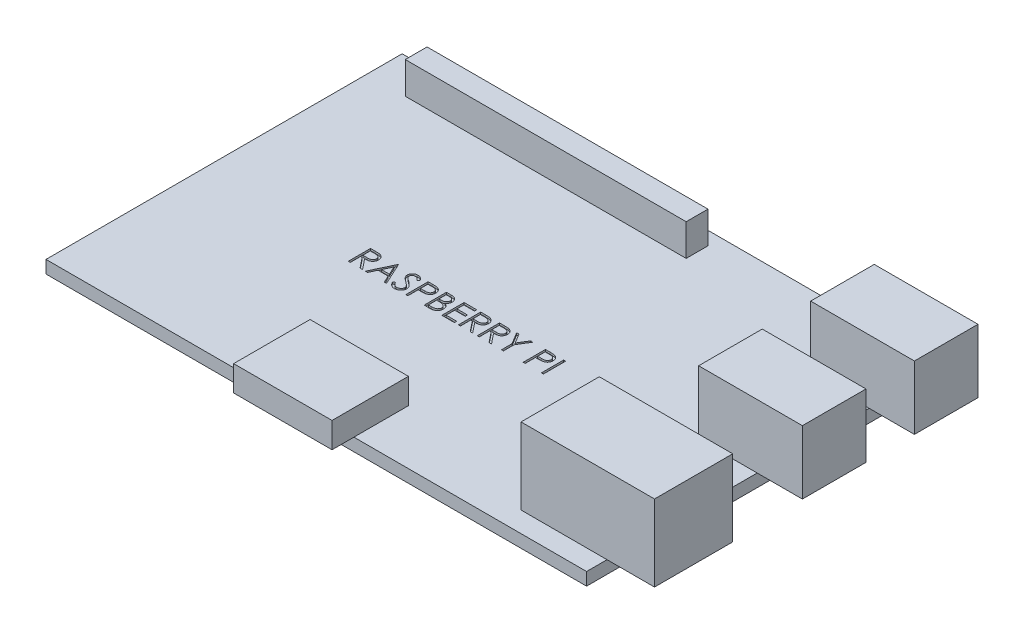
from build123d import *

# Parameters (mm, degrees)
SKETCH1_W           = 85
SKETCH1_H           = 56
BOSS_EXTRUDE1_DEPTH = 2
SKETCH2_W           = 44.16989505
SKETCH2_H           = 3.429859275
BOSS_EXTRUDE2_DEPTH = 5
SKETCH3_W           = 16.312745331
SKETCH3_H           = 10
BOSS_EXTRUDE3_DEPTH = 10
SKETCH4_W           = 20.982820563
SKETCH4_H           = 12.302427533
BOSS_EXTRUDE4_DEPTH = 12
SKETCH5_W           = 15.469882956
SKETCH5_H           = 12.011909119
BOSS_EXTRUDE5_DEPTH = 4
SKETCH6_W           = 0.314102564
SKETCH6_H           = 3.5
CUT_EXTRUDE1_DEPTH  = 0.3


with BuildPart() as part:
    # Sketch1 → Boss-Extrude1 (new body)
    with BuildSketch(Plane(origin=(0, 0, 0), x_dir=(1, 0, 0), z_dir=(0, 1, 0))):
        with Locations((42.5, 28)):
            Rectangle(SKETCH1_W, SKETCH1_H)
    extrude(amount=BOSS_EXTRUDE1_DEPTH)

    # Sketch2 → Boss-Extrude2 (add)
    with BuildSketch(Plane(origin=(0, 2, 0), x_dir=(1, 0, 0), z_dir=(0, 1, 0))):
        with Locations((28.111322067, 52.176325132)):
            Rectangle(SKETCH2_W, SKETCH2_H)
    extrude(amount=BOSS_EXTRUDE2_DEPTH)

    # Sketch3 → Boss-Extrude3 (add)
    with BuildSketch(Plane(origin=(0, 2, 0), x_dir=(1, 0, 0), z_dir=(0, 1, 0))):
        with Locations((83.951104162, 49.438227987)):
            Rectangle(SKETCH3_W, SKETCH3_H)
        with Locations((83.951104162, 31.8256135)):
            Rectangle(SKETCH3_W, SKETCH3_H)
    extrude(amount=BOSS_EXTRUDE3_DEPTH)

    # Sketch4 → Boss-Extrude4 (add)
    with BuildSketch(Plane(origin=(0, 2, 0), x_dir=(1, 0, 0), z_dir=(0, 1, 0))):
        with Locations((81.970867379, 9.368512449)):
            Rectangle(SKETCH4_W, SKETCH4_H)
    extrude(amount=BOSS_EXTRUDE4_DEPTH)

    # Sketch5 → Boss-Extrude5 (add)
    with BuildSketch(Plane(origin=(0, 2, 0), x_dir=(1, 0, 0), z_dir=(0, 1, 0))):
        with Locations((40.680180829, 2.565692434)):
            Rectangle(SKETCH5_W, SKETCH5_H)
    extrude(amount=BOSS_EXTRUDE5_DEPTH)

    # Sketch6 → Cut-Extrude1 (cut)
    # profile 1 of 11: a face of its own
    with BuildSketch(Plane(origin=(0, 2, 0), x_dir=(1, 0, 0), z_dir=(0, 1, 0))):
        with BuildLine():
            Line((24.021028214, 27.004389936), (24.721448888, 27.004389936))
            add(Edge.make_bspline(
                [(24.721448888, 27.004389936), (24.768190016, 27.00423435), (24.85793816, 27.003935608), (24.986511431, 27.002269845), (25.103338528, 26.99749549), (25.208358367, 26.993386906), (25.301569022, 26.985894965), (25.383256313, 26.978734318), (25.45304401, 26.969360657), (25.495289862, 26.960655234), (25.514417638, 26.956713654)],
                knots=[0, 0, 0, 0, 1.410062039, 2.707475311, 3.878576406, 4.937260626, 5.877586885, 6.699081471, 7.410979367, 8, 8, 8, 8], degree=3))
            add(Edge.make_bspline(
                [(25.514417638, 26.956713654), (25.540024262, 26.950386889), (25.590691251, 26.937868325), (25.663641317, 26.911408725), (25.733155641, 26.8807891), (25.798945465, 26.84482538), (25.860681257, 26.8032506), (25.918999567, 26.756782478), (25.974165031, 26.705675272), (26.023946661, 26.64864043), (26.070885713, 26.588803921), (26.110474339, 26.524100164), (26.144600819, 26.456438636), (26.171771336, 26.385131218), (26.193649309, 26.310869447), (26.209075549, 26.23298065), (26.218326736, 26.151819675), (26.219268592, 26.096461766), (26.219746163, 26.06839234)],
                knots=[0, 0, 0, 0, 1.027469482, 2.033020251, 3.019912614, 3.986113645, 4.951240523, 5.91722682, 6.890402269, 7.87763091, 8.8651537, 9.85103654, 10.82876324, 11.815024772, 12.821070561, 13.842952187, 14.906261191, 16, 16, 16, 16], degree=3))
            add(Edge.make_bspline(
                [(26.219746163, 26.06839234), (26.218277165, 26.021757236), (26.215410769, 25.930760068), (26.188685666, 25.798699186), (26.144909146, 25.675509872), (26.084585857, 25.561347234), (26.007766381, 25.458436588), (25.91544159, 25.368046133), (25.807559979, 25.292406221), (25.707130663, 25.239953416), (25.618416463, 25.206360507), (25.54538315, 25.182724148), (25.465716173, 25.164462183), (25.380178838, 25.148102051), (25.288415183, 25.135750357), (25.190645143, 25.126703762), (25.086798992, 25.121049714), (25.015459922, 25.120207709), (24.978760586, 25.119774552)],
                knots=[0, 0, 0, 0, 1.260483769, 2.459530307, 3.627416485, 4.787058657, 5.939039949, 7.08810263, 8.267026773, 9.491475466, 10.141966685, 10.831826277, 11.566392101, 12.351337768, 13.187381173, 14.07005841, 15.007169909, 16, 16, 16, 16], degree=3))
            Line((24.978760586, 25.119774552), (26.264617958, 23.504389936))
            Line((26.264617958, 23.504389936), (25.876196484, 23.504389936))
            Line((25.876196484, 23.504389936), (24.590339112, 25.119774552))
            Line((24.590339112, 25.119774552), (24.335130779, 25.119774552))
            Line((24.335130779, 25.119774552), (24.335130779, 23.504389936))
            Line((24.335130779, 23.504389936), (24.021028214, 23.504389936))
            Line((24.021028214, 23.504389936), (24.021028214, 27.004389936))
        make_face()
        with BuildLine():
            Line((24.335130779, 26.645415577), (24.335130779, 25.478748911))
            Line((24.335130779, 25.478748911), (24.975956099, 25.473841058))
            add(Edge.make_bspline(
                [(24.975956099, 25.473841058), (25.005876138, 25.473827822), (25.063869695, 25.473802165), (25.14777036, 25.477795941), (25.225890472, 25.48233926), (25.297931224, 25.489288605), (25.363924799, 25.498244677), (25.423838212, 25.509447661), (25.477769264, 25.522499724), (25.540667803, 25.54270135), (25.610904334, 25.574707368), (25.687235794, 25.621272867), (25.752238132, 25.679841986), (25.807155994, 25.746815442), (25.851285425, 25.820451691), (25.88239748, 25.89986806), (25.902139922, 25.983059658), (25.904468467, 26.040237766), (25.905643599, 26.069093462)],
                knots=[0, 0, 0, 0, 1.146690395, 2.22261258, 3.21895312, 4.145990853, 4.996080663, 5.770904154, 6.481378293, 7.121626537, 8.300444488, 9.431385265, 10.535395872, 11.636531494, 12.74115979, 13.810798291, 14.895190096, 16, 16, 16, 16], degree=3))
            add(Edge.make_bspline(
                [(25.905643599, 26.069093462), (25.904441478, 26.097240036), (25.902059313, 26.153016275), (25.882610544, 26.234672185), (25.849721163, 26.311739135), (25.805398925, 26.38390362), (25.75139977, 26.449409356), (25.688081957, 26.505456509), (25.617176762, 26.551705974), (25.550905564, 26.581260354), (25.491671351, 26.599380207), (25.440241691, 26.612131371), (25.382130213, 26.62237584), (25.317054755, 26.630583901), (25.245293124, 26.637638845), (25.166482473, 26.642390624), (25.081145693, 26.645204488), (25.021998761, 26.645343577), (24.991380779, 26.645415577)],
                knots=[0, 0, 0, 0, 1.101028733, 2.181837193, 3.264309656, 4.369019818, 5.486613113, 6.575447106, 7.666700264, 8.788928104, 9.402425223, 10.0903467, 10.862060571, 11.710948788, 12.657782767, 13.684531032, 14.801375019, 16, 16, 16, 16], degree=3))
            Line((24.991380779, 26.645415577), (24.335130779, 26.645415577))
        make_face(mode=Mode.SUBTRACT)
    # profile 2 of 11: a face of its own
    with BuildSketch(Plane(origin=(0, 2, 0), x_dir=(1, 0, 0), z_dir=(0, 1, 0))):
        Polygon((28.418464112, 27.004389936), (30.033848727, 23.504389936), (29.692402413, 23.504389936), (29.174974529, 24.626184808), (27.588335907, 24.626184808), (27.056184464, 23.504389936), (26.713335907, 23.504389936), (28.373592317, 27.004389936), align=None)
        Polygon((28.392522605, 26.32219843), (27.758708503, 24.985159167), (29.009509785, 24.985159167), align=None, mode=Mode.SUBTRACT)
    # profile 3 of 11: a face of its own
    with BuildSketch(Plane(origin=(0, 2, 0), x_dir=(1, 0, 0), z_dir=(0, 1, 0))):
        with BuildLine():
            Line((30.303079496, 24.179570225), (30.598952894, 24.356954039))
            add(Edge.make_bspline(
                [(30.598952894, 24.356954039), (30.626471131, 24.310889654), (30.679195012, 24.22263207), (30.767146371, 24.10337403), (30.858279282, 24.002011873), (30.953268616, 23.919135265), (31.051534564, 23.853886379), (31.153718618, 23.807684147), (31.259476428, 23.778868172), (31.33145025, 23.775368085), (31.367382381, 23.773620706)],
                knots=[0, 0, 0, 0, 1.272034388, 2.437168799, 3.508375237, 4.49857839, 5.41946034, 6.295179144, 7.148887113, 8, 8, 8, 8], degree=3))
            add(Edge.make_bspline(
                [(31.367382381, 23.773620706), (31.398069242, 23.774475378), (31.458906015, 23.776169768), (31.548468258, 23.792450571), (31.63545006, 23.817462699), (31.718058698, 23.853283631), (31.795154312, 23.896622117), (31.862761007, 23.948968294), (31.921207121, 24.0075745), (31.969016235, 24.072957155), (32.005696271, 24.143274303), (32.033888339, 24.215450254), (32.049533413, 24.290618823), (32.051890166, 24.341229286), (32.053079496, 24.366769744)],
                knots=[0, 0, 0, 0, 1.095163259, 2.171163733, 3.241058638, 4.321873601, 5.38011039, 6.391990106, 7.366004449, 8.327778327, 9.272591725, 10.192022065, 11.087607919, 12, 12, 12, 12], degree=3))
            add(Edge.make_bspline(
                [(32.053079496, 24.366769744), (32.051605186, 24.395910594), (32.048608128, 24.455149683), (32.023276648, 24.542549336), (31.983427401, 24.629041906), (31.946664757, 24.682543172), (31.927578695, 24.710319424)],
                knots=[0, 0, 0, 0, 0.938893495, 1.908633276, 2.914225137, 4, 4, 4, 4], degree=3))
            add(Edge.make_bspline(
                [(31.927578695, 24.710319424), (31.911908081, 24.730366247), (31.879009587, 24.772452046), (31.822452074, 24.835097281), (31.75608596, 24.8997157), (31.682182405, 24.968774757), (31.598049316, 25.039062554), (31.506321802, 25.113930832), (31.404657943, 25.190532409), (31.333358446, 25.241904974), (31.29656908, 25.268412372)],
                knots=[0, 0, 0, 0, 0.722233717, 1.516239348, 2.393582979, 3.351407094, 4.387010283, 5.505090956, 6.712668013, 8, 8, 8, 8], degree=3))
            add(Edge.make_bspline(
                [(31.29656908, 25.268412372), (31.259745084, 25.29464096), (31.189340407, 25.344788022), (31.090881825, 25.419212306), (31.002837362, 25.487256176), (30.925598345, 25.549560188), (30.859198748, 25.606132793), (30.803115337, 25.656430732), (30.75877678, 25.701814293), (30.7341212, 25.731255634), (30.723051452, 25.744474071)],
                knots=[0, 0, 0, 0, 1.452282411, 2.77665338, 3.964542531, 5.026858415, 5.96415736, 6.766646006, 7.446254459, 8, 8, 8, 8], degree=3))
            add(Edge.make_bspline(
                [(30.723051452, 25.744474071), (30.707578906, 25.765075108), (30.67715007, 25.805589812), (30.636984064, 25.868914669), (30.602844901, 25.933737935), (30.576082569, 26.000233799), (30.55354635, 26.067468728), (30.53838842, 26.136319974), (30.528897023, 26.206478592), (30.527925036, 26.253692093), (30.527438471, 26.277326635)],
                knots=[0, 0, 0, 0, 1.068054152, 2.10047183, 3.106115577, 4.101338837, 5.06977816, 6.043150881, 7.020423561, 8, 8, 8, 8], degree=3))
            add(Edge.make_bspline(
                [(30.527438471, 26.277326635), (30.52874368, 26.31435641), (30.5313262, 26.387624473), (30.553166717, 26.494655304), (30.587639611, 26.596841721), (30.635934499, 26.693172055), (30.698191852, 26.781138036), (30.770237826, 26.861751523), (30.856049312, 26.929520105), (30.950201935, 26.988732163), (31.053258308, 27.035078089), (31.161249211, 27.070039069), (31.274346283, 27.089848326), (31.350949418, 27.092691091), (31.389818279, 27.094133526)],
                knots=[0, 0, 0, 0, 1.005424448, 1.989358655, 2.955360095, 3.929531133, 4.905563448, 5.876582895, 6.856512386, 7.866279853, 8.892233794, 9.918561126, 10.94386622, 12, 12, 12, 12], degree=3))
            add(Edge.make_bspline(
                [(31.389818279, 27.094133526), (31.431062379, 27.092710975), (31.513083731, 27.089881974), (31.633732946, 27.065284442), (31.749893663, 27.02458377), (31.843336927, 26.978395112), (31.916469689, 26.932263697), (31.972242422, 26.890243872), (32.028759872, 26.841868764), (32.086477927, 26.787009518), (32.144418587, 26.725162767), (32.203442039, 26.656752078), (32.263686308, 26.582195522), (32.302442168, 26.528971021), (32.322310266, 26.50168561)],
                knots=[0, 0, 0, 0, 1.286793592, 2.559021753, 3.825965368, 5.121522368, 5.803751409, 6.523245864, 7.299691795, 8.125521123, 9.008227632, 9.944561021, 10.946284179, 12, 12, 12, 12], degree=3))
            Line((32.322310266, 26.50168561), (32.038355939, 26.286441219))
            add(Edge.make_bspline(
                [(32.038355939, 26.286441219), (32.021210006, 26.308529909), (31.988190949, 26.351067562), (31.938061462, 26.410638878), (31.890812814, 26.465055357), (31.844262415, 26.512320485), (31.800868783, 26.555022619), (31.758751741, 26.591582375), (31.71851739, 26.622357971), (31.667800479, 26.655201531), (31.604082761, 26.687758034), (31.524098225, 26.715307113), (31.440511949, 26.731862174), (31.383582318, 26.734051062), (31.354762189, 26.735159167)],
                knots=[0, 0, 0, 0, 1.181633172, 2.275549214, 3.290209073, 4.226197932, 5.078386478, 5.862611352, 6.581680152, 7.217281963, 8.414376989, 9.595101626, 10.782541182, 12, 12, 12, 12], degree=3))
            add(Edge.make_bspline(
                [(31.354762189, 26.735159167), (31.318605666, 26.733947467), (31.248881219, 26.731610818), (31.149890983, 26.706090833), (31.060797058, 26.665908972), (30.984244493, 26.609593994), (30.920507516, 26.542873002), (30.874402057, 26.466094147), (30.846651892, 26.381311744), (30.843265613, 26.322170088), (30.841541035, 26.292050193)],
                knots=[0, 0, 0, 0, 1.14458467, 2.207223713, 3.21896685, 4.227309161, 5.202851033, 6.127160689, 7.046193047, 8, 8, 8, 8], degree=3))
            add(Edge.make_bspline(
                [(30.841541035, 26.292050193), (30.841934162, 26.273298714), (30.842721058, 26.235765095), (30.853695855, 26.180313673), (30.867795184, 26.125002334), (30.890137816, 26.070079751), (30.92098312, 26.014585392), (30.961488296, 25.957563654), (31.012501608, 25.898511945), (31.05157862, 25.860104572), (31.072210105, 25.839826635)],
                knots=[0, 0, 0, 0, 0.858281714, 1.717966888, 2.583508476, 3.4729293, 4.427298488, 5.488583878, 6.674047936, 8, 8, 8, 8], degree=3))
            add(Edge.make_bspline(
                [(31.072210105, 25.839826635), (31.079871478, 25.832989609), (31.098073145, 25.816746401), (31.131349071, 25.79015412), (31.175291869, 25.757351348), (31.22875407, 25.716764032), (31.292721432, 25.669682569), (31.367200988, 25.616708957), (31.451362521, 25.556123498), (31.511084437, 25.513765958), (31.54266283, 25.491369103)],
                knots=[0, 0, 0, 0, 0.420754252, 0.999615792, 1.744751191, 2.668019286, 3.750313428, 4.999500688, 6.413464383, 8, 8, 8, 8], degree=3))
            add(Edge.make_bspline(
                [(31.54266283, 25.491369103), (31.580648743, 25.463727744), (31.6542032, 25.410204082), (31.758860779, 25.329788402), (31.853754588, 25.251140633), (31.939217791, 25.174763026), (32.0160947, 25.101234933), (32.08353242, 25.029671753), (32.142218101, 24.96058618), (32.205397319, 24.872013604), (32.269955139, 24.76323252), (32.325396646, 24.629954282), (32.360354993, 24.496157961), (32.364926509, 24.406231125), (32.367182061, 24.361861892)],
                knots=[0, 0, 0, 0, 1.163667725, 2.253281268, 3.268753668, 4.215851969, 5.092017293, 5.902905408, 6.650798638, 7.335211899, 8.59617414, 9.77448103, 10.901945474, 12, 12, 12, 12], degree=3))
            add(Edge.make_bspline(
                [(32.367182061, 24.361861892), (32.366524922, 24.330483526), (32.365223407, 24.268336143), (32.350262494, 24.177081066), (32.328342828, 24.088450196), (32.295305595, 24.003539084), (32.254982436, 23.920794321), (32.203816188, 23.842386421), (32.144508504, 23.766580022), (32.076474739, 23.695396531), (32.002028836, 23.630050335), (31.923345142, 23.571921273), (31.840294869, 23.52345295), (31.753328552, 23.483902108), (31.662426215, 23.45296859), (31.567618432, 23.430555721), (31.46874892, 23.41680001), (31.401548439, 23.415372249), (31.367382381, 23.414646347)],
                knots=[0, 0, 0, 0, 0.983748083, 1.948392443, 2.894712957, 3.844097841, 4.80183111, 5.778335162, 6.776009319, 7.81870978, 8.863265674, 9.881300176, 10.883814829, 11.87499822, 12.874611388, 13.892143829, 14.928324115, 16, 16, 16, 16], degree=3))
            add(Edge.make_bspline(
                [(31.367382381, 23.414646347), (31.340947038, 23.415157528), (31.288409278, 23.416173454), (31.210699796, 23.425154734), (31.134560207, 23.437861838), (31.060945925, 23.458035908), (30.988908513, 23.482512885), (30.918761279, 23.512651217), (30.850470225, 23.548768419), (30.783652642, 23.590063443), (30.718478467, 23.638121188), (30.655559, 23.694094684), (30.592829814, 23.756440189), (30.532142418, 23.826850753), (30.472269273, 23.904188836), (30.414390864, 23.989178019), (30.357309146, 24.081355373), (30.321493678, 24.146220458), (30.303079496, 24.179570225)],
                knots=[0, 0, 0, 0, 0.915332311, 1.819136955, 2.706846663, 3.586547465, 4.459518054, 5.340707479, 6.227863349, 7.133153174, 8.059268498, 9.028702269, 10.047606654, 11.120612155, 12.245963614, 13.433783089, 14.680604001, 16, 16, 16, 16], degree=3))
        make_face()
    # profile 4 of 11: a face of its own
    with BuildSketch(Plane(origin=(0, 2, 0), x_dir=(1, 0, 0), z_dir=(0, 1, 0))):
        with BuildLine():
            Line((33.085130779, 27.004389936), (33.771529016, 27.004389936))
            add(Edge.make_bspline(
                [(33.771529016, 27.004389936), (33.818739922, 27.00433804), (33.909198115, 27.004238605), (34.03891317, 27.001223859), (34.156722902, 26.997197167), (34.262373283, 26.991615274), (34.356189381, 26.985018683), (34.437746681, 26.975766644), (34.507686237, 26.966106348), (34.549592686, 26.956284942), (34.568704496, 26.951805802)],
                knots=[0, 0, 0, 0, 1.415646017, 2.712440637, 3.8905458, 4.950247383, 5.884950622, 6.709939814, 7.411656543, 8, 8, 8, 8], degree=3))
            add(Edge.make_bspline(
                [(34.568704496, 26.951805802), (34.59289803, 26.945183852), (34.640715007, 26.93209599), (34.709616051, 26.905882267), (34.775169896, 26.874800102), (34.837601455, 26.839376162), (34.896143538, 26.798090598), (34.951669579, 26.75261698), (35.003689559, 26.701905411), (35.051910951, 26.646524671), (35.096195748, 26.587404462), (35.134325431, 26.523662232), (35.166252658, 26.456370928), (35.19363593, 26.385577357), (35.213344384, 26.310687034), (35.228191284, 26.232220321), (35.237614911, 26.150185631), (35.238517473, 26.094125764), (35.238976932, 26.065587853)],
                knots=[0, 0, 0, 0, 0.999701418, 1.975846123, 2.934577507, 3.890451536, 4.834027766, 5.787354733, 6.749476667, 7.726910423, 8.712836071, 9.690891519, 10.682875813, 11.679750201, 12.712814741, 13.765529915, 14.8625177, 16, 16, 16, 16], degree=3))
            add(Edge.make_bspline(
                [(35.238976932, 26.065587853), (35.238555508, 26.036810076), (35.237730962, 25.980504412), (35.227834676, 25.898131624), (35.214504485, 25.819413234), (35.194007432, 25.744523784), (35.167161759, 25.673908013), (35.135669706, 25.606486781), (35.097686176, 25.543407109), (35.054041346, 25.484439992), (35.005489752, 25.429530079), (34.952236814, 25.379075285), (34.894497521, 25.333370946), (34.832455373, 25.292314603), (34.765505524, 25.256858323), (34.694663371, 25.225101018), (34.619313154, 25.198429958), (34.56717064, 25.184399896), (34.540659625, 25.177266539)],
                knots=[0, 0, 0, 0, 1.121902311, 2.195077645, 3.232258892, 4.234102512, 5.217864754, 6.176164875, 7.132989551, 8.084763148, 9.034132444, 9.988522005, 10.94243251, 11.903244335, 12.886203696, 13.894208494, 14.929344452, 16, 16, 16, 16], degree=3))
            add(Edge.make_bspline(
                [(34.540659625, 25.177266539), (34.518732291, 25.172603558), (34.470677263, 25.162384364), (34.391534541, 25.150975907), (34.299389155, 25.141238306), (34.194366875, 25.133937169), (34.07656197, 25.1276868), (33.945910713, 25.122718706), (33.802156636, 25.119988852), (33.701885392, 25.11984806), (33.649533823, 25.119774552)],
                knots=[0, 0, 0, 0, 0.601384939, 1.31797006, 2.144135048, 3.087295005, 4.142315834, 5.309527816, 6.595305764, 8, 8, 8, 8], degree=3))
            Line((33.649533823, 25.119774552), (33.399233343, 25.119774552))
            Line((33.399233343, 25.119774552), (33.399233343, 23.504389936))
            Line((33.399233343, 23.504389936), (33.085130779, 23.504389936))
            Line((33.085130779, 23.504389936), (33.085130779, 27.004389936))
        make_face()
        with BuildLine():
            Line((33.399233343, 26.645415577), (33.399233343, 25.478748911))
            Line((33.399233343, 25.478748911), (34.012013791, 25.471036571))
            add(Edge.make_bspline(
                [(34.012013791, 25.471036571), (34.041933717, 25.471021107), (34.099693517, 25.470991255), (34.18312974, 25.474976479), (34.260539028, 25.479577011), (34.331683603, 25.486312935), (34.396595538, 25.495834192), (34.455383066, 25.50544593), (34.507590349, 25.519351293), (34.568689551, 25.538074362), (34.636772899, 25.570006978), (34.710840447, 25.616356868), (34.773611033, 25.675437576), (34.82792933, 25.741865407), (34.871035208, 25.815764537), (34.9025912, 25.894833473), (34.921132358, 25.978261323), (34.923618551, 26.035349462), (34.924874368, 26.06418561)],
                knots=[0, 0, 0, 0, 1.160613943, 2.240541288, 3.23993089, 4.169200891, 5.011653406, 5.7853311, 6.478053781, 7.106038997, 8.262395093, 9.384106736, 10.481365981, 11.59014053, 12.70357646, 13.786202915, 14.881775077, 16, 16, 16, 16], degree=3))
            add(Edge.make_bspline(
                [(34.924874368, 26.06418561), (34.923611722, 26.092324123), (34.921101737, 26.148260005), (34.902445874, 26.230238766), (34.87109656, 26.30847447), (34.827639965, 26.381447555), (34.774898835, 26.447636359), (34.713599492, 26.505133487), (34.643886231, 26.551355189), (34.579038, 26.581188471), (34.521436814, 26.599403746), (34.471404854, 26.612148587), (34.414914179, 26.622324193), (34.3519464, 26.630563696), (34.282989566, 26.637617157), (34.207451251, 26.642403134), (34.125617608, 26.645204591), (34.068807037, 26.645343546), (34.039357541, 26.645415577)],
                knots=[0, 0, 0, 0, 1.120700087, 2.227813068, 3.331159281, 4.466773991, 5.599788987, 6.693661531, 7.80175334, 8.91857717, 9.525282508, 10.207424825, 10.974604443, 11.810962634, 12.737642355, 13.736264703, 14.826523623, 16, 16, 16, 16], degree=3))
            Line((34.039357541, 26.645415577), (33.399233343, 26.645415577))
        make_face(mode=Mode.SUBTRACT)
    # profile 5 of 11: a face of its own
    with BuildSketch(Plane(origin=(0, 2, 0), x_dir=(1, 0, 0), z_dir=(0, 1, 0))):
        with BuildLine():
            Line((35.95692565, 27.004389936), (36.639818279, 27.004389936))
            add(Edge.make_bspline(
                [(36.639818279, 27.004389936), (36.673246757, 27.004214186), (36.738039467, 27.003873538), (36.832258909, 26.998590407), (36.92050772, 26.991386737), (37.002811492, 26.979956644), (37.079132194, 26.966164867), (37.149699832, 26.949463051), (37.214290004, 26.929436437), (37.29140274, 26.897590156), (37.379323401, 26.850266988), (37.474521794, 26.780338423), (37.555926033, 26.69480596), (37.62611235, 26.598323304), (37.68191347, 26.492187532), (37.722282767, 26.378928344), (37.747840643, 26.260006602), (37.750469077, 26.178363424), (37.751797445, 26.137102276)],
                knots=[0, 0, 0, 0, 1.001505555, 1.941167018, 2.826882275, 3.653841531, 4.429895133, 5.150066043, 5.825578002, 6.45369114, 7.647487171, 8.808567382, 9.977351308, 11.170798116, 12.373658725, 13.556498008, 14.765093433, 16, 16, 16, 16], degree=3))
            add(Edge.make_bspline(
                [(37.751797445, 26.137102276), (37.750704227, 26.098449721), (37.748555949, 26.022493804), (37.72801319, 25.911399694), (37.695852522, 25.805648475), (37.651147272, 25.70562609), (37.593045276, 25.613592477), (37.524186958, 25.528805211), (37.441110155, 25.454854154), (37.378866915, 25.413511251), (37.34725017, 25.39251093)],
                knots=[0, 0, 0, 0, 1.044552857, 2.05264487, 3.044412934, 4.028983338, 5.005914585, 5.980388656, 6.974128949, 8, 8, 8, 8], degree=3))
            add(Edge.make_bspline(
                [(37.34725017, 25.39251093), (37.387010597, 25.377245931), (37.463082145, 25.348040207), (37.567768157, 25.296404743), (37.657963002, 25.240242632), (37.734360148, 25.178910782), (37.799697803, 25.112801971), (37.856750744, 25.040946857), (37.905432119, 24.962408099), (37.947145042, 24.878004564), (37.979693798, 24.788598096), (38.004069703, 24.695027319), (38.018037152, 24.597627764), (38.020024793, 24.531342385), (38.021028214, 24.49787952)],
                knots=[0, 0, 0, 0, 1.27268992, 2.434971085, 3.483601985, 4.442670788, 5.356604649, 6.2567628, 7.179492994, 8.113709626, 9.066344395, 10.018646069, 10.999752585, 12, 12, 12, 12], degree=3))
            add(Edge.make_bspline(
                [(38.021028214, 24.49787952), (38.020051368, 24.463712648), (38.018129397, 24.39648837), (38.003949425, 24.297733235), (37.979940318, 24.203358288), (37.946869171, 24.112753106), (37.903706857, 24.026092971), (37.851178892, 23.943279707), (37.788547329, 23.865145377), (37.71848446, 23.790821754), (37.639222314, 23.723993966), (37.553706559, 23.66447826), (37.46086024, 23.615532197), (37.362208246, 23.574416176), (37.256643929, 23.543008977), (37.144641322, 23.521036404), (37.02629702, 23.506231367), (36.945087269, 23.505014162), (36.903440073, 23.504389936)],
                knots=[0, 0, 0, 0, 0.978564426, 1.925352924, 2.850884081, 3.763762016, 4.682927383, 5.618979971, 6.567305752, 7.547517671, 8.540179244, 9.531824382, 10.526200242, 11.540722885, 12.589160233, 13.674978461, 14.80764778, 16, 16, 16, 16], degree=3))
            Line((36.903440073, 23.504389936), (35.95692565, 23.504389936))
            Line((35.95692565, 23.504389936), (35.95692565, 27.004389936))
        make_face()
        with BuildLine():
            Line((36.271028214, 26.645415577), (36.271028214, 25.523620706))
            Line((36.271028214, 25.523620706), (36.482065875, 25.523620706))
            add(Edge.make_bspline(
                [(36.482065875, 25.523620706), (36.51291467, 25.524020629), (36.572520829, 25.524793361), (36.658840726, 25.527006879), (36.738965744, 25.533204922), (36.812757577, 25.539401184), (36.880100021, 25.549475772), (36.940843883, 25.561467895), (36.99594248, 25.5741508), (37.059482025, 25.595720287), (37.131554974, 25.627597962), (37.208388078, 25.677069798), (37.276122547, 25.735994151), (37.333319735, 25.803985113), (37.380131206, 25.878851299), (37.412644921, 25.959398179), (37.434692205, 26.043618311), (37.436683736, 26.101436564), (37.437694881, 26.13079218)],
                knots=[0, 0, 0, 0, 1.156816544, 2.235205308, 3.236616184, 4.169592532, 5.011045266, 5.787822928, 6.49130361, 7.128639758, 8.301311294, 9.436451833, 10.541879658, 11.654887649, 12.756523258, 13.837046038, 14.901820046, 16, 16, 16, 16], degree=3))
            add(Edge.make_bspline(
                [(37.437694881, 26.13079218), (37.437168701, 26.150217952), (37.436136541, 26.188323724), (37.427683238, 26.243873078), (37.413315664, 26.29611683), (37.394861371, 26.345770941), (37.369072682, 26.391282791), (37.338709219, 26.434225987), (37.302023528, 26.473138105), (37.260266216, 26.509507603), (37.212257593, 26.541752131), (37.158026301, 26.569992894), (37.096838624, 26.592733671), (37.029725769, 26.612649824), (36.955654682, 26.626638117), (36.875480128, 26.638291505), (36.788545409, 26.644224247), (36.728400307, 26.64500961), (36.697310266, 26.645415577)],
                knots=[0, 0, 0, 0, 0.91205012, 1.789085906, 2.630437955, 3.453916878, 4.269457761, 5.079663411, 5.91843418, 6.774407191, 7.675494373, 8.627863946, 9.638891023, 10.736472738, 11.911756761, 13.175263542, 14.539845004, 16, 16, 16, 16], degree=3))
            Line((36.697310266, 26.645415577), (36.271028214, 26.645415577))
        make_face(mode=Mode.SUBTRACT)
        with BuildLine():
            Line((36.271028214, 25.164646347), (36.271028214, 23.863364295))
            Line((36.271028214, 23.863364295), (36.71834392, 23.863364295))
            add(Edge.make_bspline(
                [(36.71834392, 23.863364295), (36.750362845, 23.863748043), (36.812075104, 23.864487665), (36.901176334, 23.86690222), (36.983759438, 23.872394496), (37.059447574, 23.881040345), (37.129058026, 23.890418794), (37.191755729, 23.903030075), (37.248048923, 23.917479036), (37.313323231, 23.939813208), (37.386826739, 23.974509679), (37.466037595, 24.026823905), (37.536463813, 24.089147213), (37.596269073, 24.161278127), (37.645282061, 24.239709454), (37.680937516, 24.322854804), (37.702928373, 24.409340332), (37.705590542, 24.468307044), (37.70692565, 24.49787952)],
                knots=[0, 0, 0, 0, 1.160039823, 2.235823828, 3.228722157, 4.157150951, 4.99529583, 5.772374946, 6.472645482, 7.099169577, 8.269452708, 9.405989375, 10.527446681, 11.663510218, 12.788923519, 13.866172445, 14.929861265, 16, 16, 16, 16], degree=3))
            add(Edge.make_bspline(
                [(37.70692565, 24.49787952), (37.706649546, 24.51637286), (37.706101791, 24.553061242), (37.697841176, 24.606977061), (37.685827306, 24.659202935), (37.670295872, 24.709880675), (37.647676405, 24.758094051), (37.62126986, 24.804796611), (37.590308459, 24.85005009), (37.542064293, 24.907262344), (37.471892308, 24.973179357), (37.372185533, 25.037716859), (37.258813235, 25.089764666), (37.176585742, 25.111864142), (37.134109144, 25.123280161)],
                knots=[0, 0, 0, 0, 0.723448775, 1.435228256, 2.130040452, 2.821711965, 3.505591119, 4.210454504, 4.921174351, 5.648778258, 7.137944449, 8.670945889, 10.280296675, 12, 12, 12, 12], degree=3))
            add(Edge.make_bspline(
                [(37.134109144, 25.123280161), (37.117080048, 25.126735245), (37.080157456, 25.134226579), (37.019949875, 25.142134283), (36.951214006, 25.149179343), (36.873791129, 25.1543905), (36.787583288, 25.159777044), (36.692406369, 25.161871865), (36.588649055, 25.164371125), (36.516656682, 25.164552259), (36.479261388, 25.164646347)],
                knots=[0, 0, 0, 0, 0.634451884, 1.375622551, 2.216452059, 3.157844607, 4.20941857, 5.370758133, 6.634282058, 8, 8, 8, 8], degree=3))
            Line((36.479261388, 25.164646347), (36.271028214, 25.164646347))
        make_face(mode=Mode.SUBTRACT)
    # profile 6 of 11: a face of its own
    with BuildSketch(Plane(origin=(0, 2, 0), x_dir=(1, 0, 0), z_dir=(0, 1, 0))):
        Polygon((38.738976932, 27.004389936), (40.713335907, 27.004389936), (40.713335907, 26.645415577), (39.053079496, 26.645415577), (39.053079496, 25.568492501), (40.713335907, 25.568492501), (40.713335907, 25.209518142), (39.053079496, 25.209518142), (39.053079496, 23.863364295), (40.713335907, 23.863364295), (40.713335907, 23.504389936), (38.738976932, 23.504389936), align=None)
    # profile 7 of 11: a face of its own
    with BuildSketch(Plane(origin=(0, 2, 0), x_dir=(1, 0, 0), z_dir=(0, 1, 0))):
        with BuildLine():
            Line((41.341541035, 27.004389936), (42.041961708, 27.004389936))
            add(Edge.make_bspline(
                [(42.041961708, 27.004389936), (42.088702837, 27.00423435), (42.178450981, 27.003935608), (42.307024251, 27.002269845), (42.423851348, 26.99749549), (42.528871188, 26.993386906), (42.622081843, 26.985894965), (42.703769133, 26.978734318), (42.773556831, 26.969360657), (42.815802682, 26.960655234), (42.834930458, 26.956713654)],
                knots=[0, 0, 0, 0, 1.410062039, 2.707475311, 3.878576406, 4.937260626, 5.877586885, 6.699081471, 7.410979367, 8, 8, 8, 8], degree=3))
            add(Edge.make_bspline(
                [(42.834930458, 26.956713654), (42.860537082, 26.950386889), (42.911204072, 26.937868325), (42.984154138, 26.911408725), (43.053668462, 26.8807891), (43.119458286, 26.84482538), (43.181194077, 26.8032506), (43.239512388, 26.756782478), (43.294677851, 26.705675272), (43.344459482, 26.64864043), (43.391398533, 26.588803921), (43.43098716, 26.524100164), (43.465113639, 26.456438636), (43.492284156, 26.385131218), (43.51416213, 26.310869447), (43.529588369, 26.23298065), (43.538839557, 26.151819675), (43.539781412, 26.096461766), (43.540258984, 26.06839234)],
                knots=[0, 0, 0, 0, 1.027469482, 2.033020251, 3.019912614, 3.986113645, 4.951240523, 5.91722682, 6.890402269, 7.87763091, 8.8651537, 9.85103654, 10.82876324, 11.815024772, 12.821070561, 13.842952187, 14.906261191, 16, 16, 16, 16], degree=3))
            add(Edge.make_bspline(
                [(43.540258984, 26.06839234), (43.538789986, 26.021757236), (43.53592359, 25.930760068), (43.509198486, 25.798699186), (43.465421966, 25.675509872), (43.405098677, 25.561347234), (43.328279202, 25.458436588), (43.235954411, 25.368046133), (43.128072799, 25.292406221), (43.027643483, 25.239953416), (42.938929283, 25.206360507), (42.865895971, 25.182724148), (42.786228993, 25.164462183), (42.700691659, 25.148102051), (42.608928003, 25.135750357), (42.511157964, 25.126703762), (42.407311812, 25.121049714), (42.335972743, 25.120207709), (42.299273407, 25.119774552)],
                knots=[0, 0, 0, 0, 1.260483769, 2.459530307, 3.627416485, 4.787058657, 5.939039949, 7.08810263, 8.267026773, 9.491475466, 10.141966685, 10.831826277, 11.566392101, 12.351337768, 13.187381173, 14.07005841, 15.007169909, 16, 16, 16, 16], degree=3))
            Line((42.299273407, 25.119774552), (43.585130779, 23.504389936))
            Line((43.585130779, 23.504389936), (43.196709304, 23.504389936))
            Line((43.196709304, 23.504389936), (41.910851932, 25.119774552))
            Line((41.910851932, 25.119774552), (41.655643599, 25.119774552))
            Line((41.655643599, 25.119774552), (41.655643599, 23.504389936))
            Line((41.655643599, 23.504389936), (41.341541035, 23.504389936))
            Line((41.341541035, 23.504389936), (41.341541035, 27.004389936))
        make_face()
        with BuildLine():
            Line((41.655643599, 26.645415577), (41.655643599, 25.478748911))
            Line((41.655643599, 25.478748911), (42.29646892, 25.473841058))
            add(Edge.make_bspline(
                [(42.29646892, 25.473841058), (42.326388958, 25.473827822), (42.384382516, 25.473802165), (42.46828318, 25.477795941), (42.546403292, 25.48233926), (42.618444044, 25.489288605), (42.68443762, 25.498244677), (42.744351033, 25.509447661), (42.798282085, 25.522499724), (42.861180623, 25.54270135), (42.931417155, 25.574707368), (43.007748614, 25.621272867), (43.072750952, 25.679841986), (43.127668814, 25.746815442), (43.171798246, 25.820451691), (43.2029103, 25.89986806), (43.222652743, 25.983059658), (43.224981288, 26.040237766), (43.22615642, 26.069093462)],
                knots=[0, 0, 0, 0, 1.146690395, 2.22261258, 3.21895312, 4.145990853, 4.996080663, 5.770904154, 6.481378293, 7.121626537, 8.300444488, 9.431385265, 10.535395872, 11.636531494, 12.74115979, 13.810798291, 14.895190096, 16, 16, 16, 16], degree=3))
            add(Edge.make_bspline(
                [(43.22615642, 26.069093462), (43.224954298, 26.097240036), (43.222572133, 26.153016275), (43.203123365, 26.234672185), (43.170233983, 26.311739135), (43.125911745, 26.38390362), (43.07191259, 26.449409356), (43.008594778, 26.505456509), (42.937689583, 26.551705974), (42.871418384, 26.581260354), (42.812184172, 26.599380207), (42.760754512, 26.612131371), (42.702643034, 26.62237584), (42.637567575, 26.630583901), (42.565805945, 26.637638845), (42.486995293, 26.642390624), (42.401658513, 26.645204488), (42.342511582, 26.645343577), (42.311893599, 26.645415577)],
                knots=[0, 0, 0, 0, 1.101028733, 2.181837193, 3.264309656, 4.369019818, 5.486613113, 6.575447106, 7.666700264, 8.788928104, 9.402425223, 10.0903467, 10.862060571, 11.710948788, 12.657782767, 13.684531032, 14.801375019, 16, 16, 16, 16], degree=3))
            Line((42.311893599, 26.645415577), (41.655643599, 26.645415577))
        make_face(mode=Mode.SUBTRACT)
    # profile 8 of 11: a face of its own
    with BuildSketch(Plane(origin=(0, 2, 0), x_dir=(1, 0, 0), z_dir=(0, 1, 0))):
        with BuildLine():
            Line((44.303079496, 27.004389936), (45.00350017, 27.004389936))
            add(Edge.make_bspline(
                [(45.00350017, 27.004389936), (45.050241298, 27.00423435), (45.139989442, 27.003935608), (45.268562713, 27.002269845), (45.38538981, 26.99749549), (45.490409649, 26.993386906), (45.583620304, 26.985894965), (45.665307595, 26.978734318), (45.735095292, 26.969360657), (45.777341144, 26.960655234), (45.79646892, 26.956713654)],
                knots=[0, 0, 0, 0, 1.410062039, 2.707475311, 3.878576406, 4.937260626, 5.877586885, 6.699081471, 7.410979367, 8, 8, 8, 8], degree=3))
            add(Edge.make_bspline(
                [(45.79646892, 26.956713654), (45.822075544, 26.950386889), (45.872742533, 26.937868325), (45.945692599, 26.911408725), (46.015206923, 26.8807891), (46.080996747, 26.84482538), (46.142732539, 26.8032506), (46.201050849, 26.756782478), (46.256216313, 26.705675272), (46.305997943, 26.64864043), (46.352936995, 26.588803921), (46.392525621, 26.524100164), (46.426652101, 26.456438636), (46.453822618, 26.385131218), (46.475700591, 26.310869447), (46.491126831, 26.23298065), (46.500378018, 26.151819675), (46.501319874, 26.096461766), (46.501797445, 26.06839234)],
                knots=[0, 0, 0, 0, 1.027469482, 2.033020251, 3.019912614, 3.986113645, 4.951240523, 5.91722682, 6.890402269, 7.87763091, 8.8651537, 9.85103654, 10.82876324, 11.815024772, 12.821070561, 13.842952187, 14.906261191, 16, 16, 16, 16], degree=3))
            add(Edge.make_bspline(
                [(46.501797445, 26.06839234), (46.500328447, 26.021757236), (46.497462051, 25.930760068), (46.470736948, 25.798699186), (46.426960428, 25.675509872), (46.366637139, 25.561347234), (46.289817663, 25.458436588), (46.197492872, 25.368046133), (46.089611261, 25.292406221), (45.989181945, 25.239953416), (45.900467745, 25.206360507), (45.827434432, 25.182724148), (45.747767455, 25.164462183), (45.66223012, 25.148102051), (45.570466465, 25.135750357), (45.472696425, 25.126703762), (45.368850274, 25.121049714), (45.297511204, 25.120207709), (45.260811868, 25.119774552)],
                knots=[0, 0, 0, 0, 1.260483769, 2.459530307, 3.627416485, 4.787058657, 5.939039949, 7.08810263, 8.267026773, 9.491475466, 10.141966685, 10.831826277, 11.566392101, 12.351337768, 13.187381173, 14.07005841, 15.007169909, 16, 16, 16, 16], degree=3))
            Line((45.260811868, 25.119774552), (46.54666924, 23.504389936))
            Line((46.54666924, 23.504389936), (46.158247766, 23.504389936))
            Line((46.158247766, 23.504389936), (44.872390394, 25.119774552))
            Line((44.872390394, 25.119774552), (44.617182061, 25.119774552))
            Line((44.617182061, 25.119774552), (44.617182061, 23.504389936))
            Line((44.617182061, 23.504389936), (44.303079496, 23.504389936))
            Line((44.303079496, 23.504389936), (44.303079496, 27.004389936))
        make_face()
        with BuildLine():
            Line((44.617182061, 26.645415577), (44.617182061, 25.478748911))
            Line((44.617182061, 25.478748911), (45.258007381, 25.473841058))
            add(Edge.make_bspline(
                [(45.258007381, 25.473841058), (45.28792742, 25.473827822), (45.345920977, 25.473802165), (45.429821642, 25.477795941), (45.507941754, 25.48233926), (45.579982506, 25.489288605), (45.645976081, 25.498244677), (45.705889494, 25.509447661), (45.759820546, 25.522499724), (45.822719085, 25.54270135), (45.892955616, 25.574707368), (45.969287076, 25.621272867), (46.034289414, 25.679841986), (46.089207276, 25.746815442), (46.133336707, 25.820451691), (46.164448762, 25.89986806), (46.184191204, 25.983059658), (46.18651975, 26.040237766), (46.187694881, 26.069093462)],
                knots=[0, 0, 0, 0, 1.146690395, 2.22261258, 3.21895312, 4.145990853, 4.996080663, 5.770904154, 6.481378293, 7.121626537, 8.300444488, 9.431385265, 10.535395872, 11.636531494, 12.74115979, 13.810798291, 14.895190096, 16, 16, 16, 16], degree=3))
            add(Edge.make_bspline(
                [(46.187694881, 26.069093462), (46.18649276, 26.097240036), (46.184110595, 26.153016275), (46.164661826, 26.234672185), (46.131772445, 26.311739135), (46.087450207, 26.38390362), (46.033451052, 26.449409356), (45.970133239, 26.505456509), (45.899228044, 26.551705974), (45.832956846, 26.581260354), (45.773722633, 26.599380207), (45.722292973, 26.612131371), (45.664181495, 26.62237584), (45.599106037, 26.630583901), (45.527344406, 26.637638845), (45.448533755, 26.642390624), (45.363196975, 26.645204488), (45.304050044, 26.645343577), (45.273432061, 26.645415577)],
                knots=[0, 0, 0, 0, 1.101028733, 2.181837193, 3.264309656, 4.369019818, 5.486613113, 6.575447106, 7.666700264, 8.788928104, 9.402425223, 10.0903467, 10.862060571, 11.710948788, 12.657782767, 13.684531032, 14.801375019, 16, 16, 16, 16], degree=3))
            Line((45.273432061, 26.645415577), (44.617182061, 26.645415577))
        make_face(mode=Mode.SUBTRACT)
    # profile 9 of 11: a face of its own
    with BuildSketch(Plane(origin=(0, 2, 0), x_dir=(1, 0, 0), z_dir=(0, 1, 0))):
        Polygon((46.995387189, 27.004389936), (47.35506267, 27.004389936), (48.274934464, 25.500483686), (49.193404016, 27.004389936), (49.553079496, 27.004389936), (48.431284625, 25.168151956), (48.431284625, 23.504389936), (48.117182061, 23.504389936), (48.117182061, 25.168151956), align=None)
    # profile 10 of 11: a face of its own
    with BuildSketch(Plane(origin=(0, 2, 0), x_dir=(1, 0, 0), z_dir=(0, 1, 0))):
        with BuildLine():
            Line((51.527438471, 27.004389936), (52.213836708, 27.004389936))
            add(Edge.make_bspline(
                [(52.213836708, 27.004389936), (52.261047614, 27.00433804), (52.351505807, 27.004238605), (52.481220863, 27.001223859), (52.599030594, 26.997197167), (52.704680975, 26.991615274), (52.798497073, 26.985018683), (52.880054373, 26.975766644), (52.949993929, 26.966106348), (52.991900379, 26.956284942), (53.011012189, 26.951805802)],
                knots=[0, 0, 0, 0, 1.415646017, 2.712440637, 3.8905458, 4.950247383, 5.884950622, 6.709939814, 7.411656543, 8, 8, 8, 8], degree=3))
            add(Edge.make_bspline(
                [(53.011012189, 26.951805802), (53.035205723, 26.945183852), (53.0830227, 26.93209599), (53.151923743, 26.905882267), (53.217477588, 26.874800102), (53.279909147, 26.839376162), (53.33845123, 26.798090598), (53.393977271, 26.75261698), (53.445997251, 26.701905411), (53.494218643, 26.646524671), (53.538503441, 26.587404462), (53.576633123, 26.523662232), (53.60856035, 26.456370928), (53.635943622, 26.385577357), (53.655652076, 26.310687034), (53.670498976, 26.232220321), (53.679922604, 26.150185631), (53.680825165, 26.094125764), (53.681284625, 26.065587853)],
                knots=[0, 0, 0, 0, 0.999701418, 1.975846123, 2.934577507, 3.890451536, 4.834027766, 5.787354733, 6.749476667, 7.726910423, 8.712836071, 9.690891519, 10.682875813, 11.679750201, 12.712814741, 13.765529915, 14.8625177, 16, 16, 16, 16], degree=3))
            add(Edge.make_bspline(
                [(53.681284625, 26.065587853), (53.6808632, 26.036810076), (53.680038654, 25.980504412), (53.670142369, 25.898131624), (53.656812177, 25.819413234), (53.636315125, 25.744523784), (53.609469452, 25.673908013), (53.577977399, 25.606486781), (53.539993868, 25.543407109), (53.496349039, 25.484439992), (53.447797444, 25.429530079), (53.394544506, 25.379075285), (53.336805214, 25.333370946), (53.274763066, 25.292314603), (53.207813217, 25.256858323), (53.136971063, 25.225101018), (53.061620847, 25.198429958), (53.009478333, 25.184399896), (52.982967317, 25.177266539)],
                knots=[0, 0, 0, 0, 1.121902311, 2.195077645, 3.232258892, 4.234102512, 5.217864754, 6.176164875, 7.132989551, 8.084763148, 9.034132444, 9.988522005, 10.94243251, 11.903244335, 12.886203696, 13.894208494, 14.929344452, 16, 16, 16, 16], degree=3))
            add(Edge.make_bspline(
                [(52.982967317, 25.177266539), (52.961039983, 25.172603558), (52.912984956, 25.162384364), (52.833842233, 25.150975907), (52.741696848, 25.141238306), (52.636674568, 25.133937169), (52.518869663, 25.1276868), (52.388218405, 25.122718706), (52.244464328, 25.119988852), (52.144193084, 25.11984806), (52.091841516, 25.119774552)],
                knots=[0, 0, 0, 0, 0.601384939, 1.31797006, 2.144135048, 3.087295005, 4.142315834, 5.309527816, 6.595305764, 8, 8, 8, 8], degree=3))
            Line((52.091841516, 25.119774552), (51.841541035, 25.119774552))
            Line((51.841541035, 25.119774552), (51.841541035, 23.504389936))
            Line((51.841541035, 23.504389936), (51.527438471, 23.504389936))
            Line((51.527438471, 23.504389936), (51.527438471, 27.004389936))
        make_face()
        with BuildLine():
            Line((51.841541035, 26.645415577), (51.841541035, 25.478748911))
            Line((51.841541035, 25.478748911), (52.454321484, 25.471036571))
            add(Edge.make_bspline(
                [(52.454321484, 25.471036571), (52.484241409, 25.471021107), (52.542001209, 25.470991255), (52.625437433, 25.474976479), (52.70284672, 25.479577011), (52.773991295, 25.486312935), (52.83890323, 25.495834192), (52.897690759, 25.50544593), (52.949898042, 25.519351293), (53.010997243, 25.538074362), (53.079080591, 25.570006978), (53.153148139, 25.616356868), (53.215918726, 25.675437576), (53.270237022, 25.741865407), (53.3133429, 25.815764537), (53.344898893, 25.894833473), (53.36344005, 25.978261323), (53.365926244, 26.035349462), (53.367182061, 26.06418561)],
                knots=[0, 0, 0, 0, 1.160613943, 2.240541288, 3.23993089, 4.169200891, 5.011653406, 5.7853311, 6.478053781, 7.106038997, 8.262395093, 9.384106736, 10.481365981, 11.59014053, 12.70357646, 13.786202915, 14.881775077, 16, 16, 16, 16], degree=3))
            add(Edge.make_bspline(
                [(53.367182061, 26.06418561), (53.365919414, 26.092324123), (53.363409429, 26.148260005), (53.344753566, 26.230238766), (53.313404252, 26.30847447), (53.269947658, 26.381447555), (53.217206528, 26.447636359), (53.155907185, 26.505133487), (53.086193923, 26.551355189), (53.021345692, 26.581188471), (52.963744506, 26.599403746), (52.913712546, 26.612148587), (52.857221872, 26.622324193), (52.794254092, 26.630563696), (52.725297258, 26.637617157), (52.649758943, 26.642403134), (52.5679253, 26.645204591), (52.511114729, 26.645343546), (52.481665234, 26.645415577)],
                knots=[0, 0, 0, 0, 1.120700087, 2.227813068, 3.331159281, 4.466773991, 5.599788987, 6.693661531, 7.80175334, 8.91857717, 9.525282508, 10.207424825, 10.974604443, 11.810962634, 12.737642355, 13.736264703, 14.826523623, 16, 16, 16, 16], degree=3))
            Line((52.481665234, 26.645415577), (51.841541035, 26.645415577))
        make_face(mode=Mode.SUBTRACT)
    # profile 11 of 11: a face of its own
    with BuildSketch(Plane(origin=(0, 2, 0), x_dir=(1, 0, 0), z_dir=(0, 1, 0))):
        with Locations((54.556284625, 25.254389936)):
            Rectangle(SKETCH6_W, SKETCH6_H)
    extrude(amount=-CUT_EXTRUDE1_DEPTH, mode=Mode.SUBTRACT)


solid = part.part
